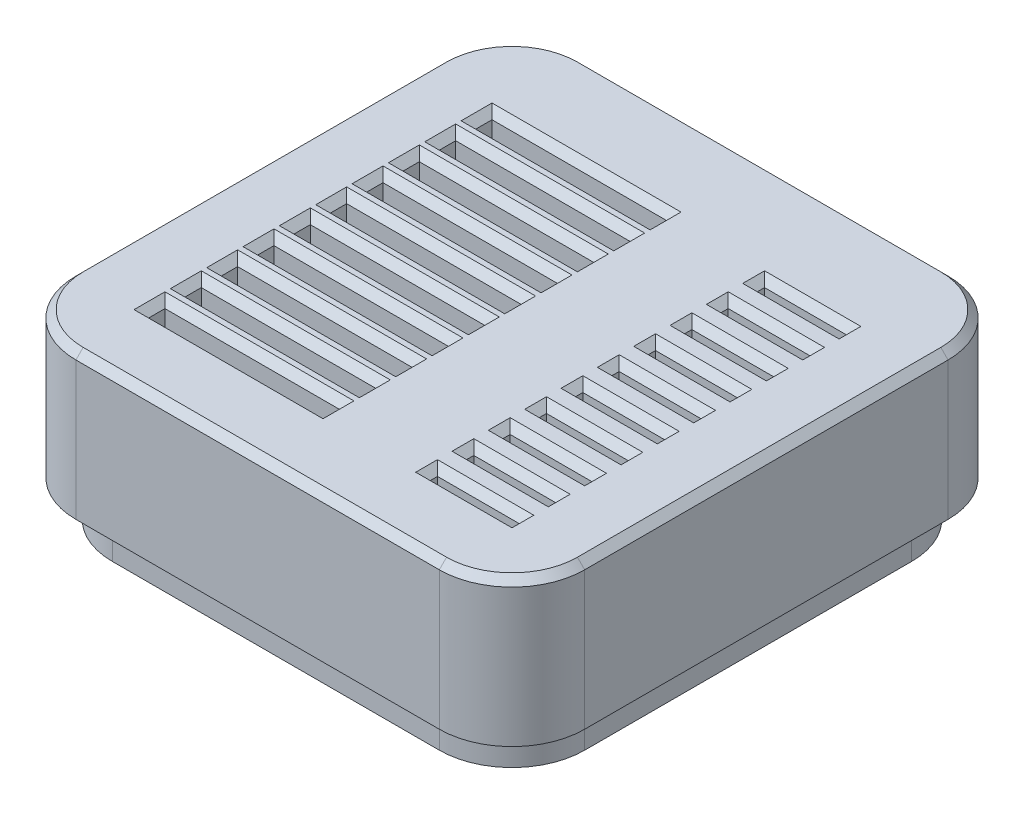
from build123d import *

# Parameters (mm, degrees)
BOSS_EXTRUDE4_DEPTH = 5
SKETCH6_W           = 70
SKETCH6_H           = 70
BOSS_EXTRUDE5_DEPTH = 20
SKETCH8_R           = 3
CUT_EXTRUDE1_DEPTH  = 2
FILLET1_R           = 10
SKETCH9_W           = 24
SKETCH9_H           = 2.25
CUT_EXTRUDE2_DEPTH  = 15
SKETCH10_W          = 11.25
SKETCH10_H          = 1
CUT_EXTRUDE3_DEPTH  = 10
CHAMFER1_SIZE       = 1


with BuildPart() as part:
    # Sketch5 → Boss-Extrude4 (new body)
    with BuildSketch(Plane(origin=(0, 0, 0), x_dir=(1, 0, 0), z_dir=(0, 1, 0))):
        with BuildLine():
            Line((-22.5, -32.5), (22.5, -32.5))
            ThreePointArc((22.5, -32.5), (29.571067812, -29.571067812), (32.5, -22.5))
            Line((32.5, -22.5), (32.5, 22.5))
            ThreePointArc((32.5, 22.5), (29.571067812, 29.571067812), (22.5, 32.5))
            Line((22.5, 32.5), (-22.5, 32.5))
            ThreePointArc((-22.5, 32.5), (-29.571067812, 29.571067812), (-32.5, 22.5))
            Line((-32.5, 22.5), (-32.5, -22.5))
            ThreePointArc((-32.5, -22.5), (-29.571067812, -29.571067812), (-22.5, -32.5))
        make_face()
    extrude(amount=BOSS_EXTRUDE4_DEPTH)

    # Sketch6 → Boss-Extrude5 (add)
    with BuildSketch(Plane(origin=(0, 5, 0), x_dir=(1, 0, 0), z_dir=(0, 1, 0))):
        Rectangle(SKETCH6_W, SKETCH6_H)
    extrude(amount=BOSS_EXTRUDE5_DEPTH)

    # Sketch8 → Cut-Extrude1 (cut)
    with BuildSketch(Plane.XZ):
        with Locations(Location((26.037533906, -26.035533906, 0), (0, 0, 270))):
            Circle(SKETCH8_R)
        with Locations(Location((26.036533906, 26.036533906, 0), (0, 0, 270))):
            Circle(SKETCH8_R)
        with BuildLine():
            ThreePointArc((-23.035533906, 26.035533906), (-24.887483609, 28.807172503), (-28.156854249, 28.156854249))
            Line((-28.156854249, 28.156854249), (-23.914213562, 23.914213562))
            ThreePointArc((-23.914213562, 23.914213562), (-23.263895308, 24.887483609), (-23.035533906, 26.035533906))
        make_face()
        with BuildLine():
            Line((-23.914213562, 23.914213562), (-28.156854249, 28.156854249))
            ThreePointArc((-28.156854249, 28.156854249), (-28.156854249, 23.914213562), (-23.914213562, 23.914213562))
        make_face()
        with Locations(Location((-26.034533906, -26.036533906, 0), (0, 0, 270))):
            Circle(SKETCH8_R)
    extrude(amount=-CUT_EXTRUDE1_DEPTH, mode=Mode.SUBTRACT)

    # Fillet1
    fillet1_edges = [part.edges().sort_by_distance(p)[0] for p in [
        (-35, 15, -35),
        (-35, 15, 35),
        (35, 15, 35),
        (35, 15, -35),
    ]]
    fillet(fillet1_edges, radius=FILLET1_R)

    # Sketch9 → Cut-Extrude2 (cut)
    with BuildSketch(Plane(origin=(0, 25, 0), x_dir=(1, 0, 0), z_dir=(0, 1, 0))):
        with Locations((-13, -23.875)):
            Rectangle(SKETCH9_W, SKETCH9_H)
        with Locations((-13, -18.875)):
            Rectangle(SKETCH9_W, SKETCH9_H)
        with Locations((-13, -13.875)):
            Rectangle(SKETCH9_W, SKETCH9_H)
        with Locations((-13, -3.875)):
            Rectangle(SKETCH9_W, SKETCH9_H)
        with Locations((-13, 1.125)):
            Rectangle(SKETCH9_W, SKETCH9_H)
        with Locations((-13, 6.125)):
            Rectangle(SKETCH9_W, SKETCH9_H)
        with Locations((-13, 11.125)):
            Rectangle(SKETCH9_W, SKETCH9_H)
        with Locations((-13, 16.125)):
            Rectangle(SKETCH9_W, SKETCH9_H)
        with Locations((-13, 21.125)):
            Rectangle(SKETCH9_W, SKETCH9_H)
        with Locations((-13, -8.875)):
            Rectangle(SKETCH9_W, SKETCH9_H)
    extrude(amount=-CUT_EXTRUDE2_DEPTH, mode=Mode.SUBTRACT)

    # Sketch10 → Cut-Extrude3 (cut)
    with BuildSketch(Plane(origin=(0, 25, 0), x_dir=(1, 0, 0), z_dir=(0, 1, 0))):
        with Locations((19.375, -24.5)):
            Rectangle(SKETCH10_W, SKETCH10_H)
        with Locations((19.375, -19.5)):
            Rectangle(SKETCH10_W, SKETCH10_H)
        with Locations((19.375, -14.5)):
            Rectangle(SKETCH10_W, SKETCH10_H)
        with Locations((19.375, -9.5)):
            Rectangle(SKETCH10_W, SKETCH10_H)
        with Locations((19.375, 0.5)):
            Rectangle(SKETCH10_W, SKETCH10_H)
        with Locations((19.375, 5.5)):
            Rectangle(SKETCH10_W, SKETCH10_H)
        with Locations((19.375, 10.5)):
            Rectangle(SKETCH10_W, SKETCH10_H)
        with Locations((19.375, 15.5)):
            Rectangle(SKETCH10_W, SKETCH10_H)
        with Locations((19.375, 20.5)):
            Rectangle(SKETCH10_W, SKETCH10_H)
        with Locations((19.375, -4.5)):
            Rectangle(SKETCH10_W, SKETCH10_H)
    extrude(amount=-CUT_EXTRUDE3_DEPTH, mode=Mode.SUBTRACT)

    # Chamfer1
    chamfer1_edges = [part.edges().sort_by_distance(p)[0] for p in [
        (-25, 25, 23.875),
        (-13, 25, 22.75),
        (-13, 25, 25),
        (-1, 25, 23.875),
        (-25, 25, 8.875),
        (-13, 25, 7.75),
        (-13, 25, 10),
        (-1, 25, 8.875),
        (-13, 25, -22.25),
        (-25, 25, -21.125),
        (-13, 25, -20),
        (-1, 25, -21.125),
        (-13, 25, -17.25),
        (-25, 25, -16.125),
        (-13, 25, -15),
        (-1, 25, -16.125),
        (-13, 25, -12.25),
        (-25, 25, -11.125),
        (-13, 25, -10),
        (-1, 25, -11.125),
        (-13, 25, -7.25),
        (-25, 25, -6.125),
        (-13, 25, -5),
        (-1, 25, -6.125),
        (-13, 25, -2.25),
        (-25, 25, -1.125),
        (-13, 25, 0),
        (-1, 25, -1.125),
        (-13, 25, 2.75),
        (-25, 25, 3.875),
        (-13, 25, 5),
        (-1, 25, 3.875),
        (-13, 25, 12.75),
        (-25, 25, 13.875),
        (-13, 25, 15),
        (-1, 25, 13.875),
        (-13, 25, 17.75),
        (-25, 25, 18.875),
        (-13, 25, 20),
        (-1, 25, 18.875),
        (13.75, 25, 24.5),
        (25, 25, 24.5),
        (19.375, 25, 25),
        (19.375, 25, 24),
        (19.375, 25, 5),
        (13.75, 25, 4.5),
        (25, 25, 4.5),
        (19.375, 25, 4),
        (25, 25, -20.5),
        (19.375, 25, -20),
        (13.75, 25, -20.5),
        (19.375, 25, -21),
        (25, 25, -15.5),
        (19.375, 25, -15),
        (13.75, 25, -15.5),
        (19.375, 25, -16),
        (25, 25, -10.5),
        (19.375, 25, -10),
        (13.75, 25, -10.5),
        (19.375, 25, -11),
        (25, 25, -5.5),
        (19.375, 25, -5),
        (13.75, 25, -5.5),
        (19.375, 25, -6),
        (25, 25, -0.5),
        (19.375, 25, 0),
        (13.75, 25, -0.5),
        (19.375, 25, -1),
        (25, 25, 9.5),
        (19.375, 25, 10),
        (13.75, 25, 9.5),
        (19.375, 25, 9),
        (25, 25, 14.5),
        (19.375, 25, 15),
        (13.75, 25, 14.5),
        (19.375, 25, 14),
        (19.375, 25, 20),
        (13.75, 25, 19.5),
        (25, 25, 19.5),
        (19.375, 25, 19),
        (-35, 25, 0),
        (0, 25, -35),
        (0, 25, 35),
        (35, 25, 0),
        (32.071067812, 25, -32.071067812),
        (32.071067812, 25, 32.071067812),
        (-32.071067812, 25, 32.071067812),
        (-32.071067812, 25, -32.071067812),
    ]]
    chamfer(chamfer1_edges, length=CHAMFER1_SIZE)


solid = part.part
